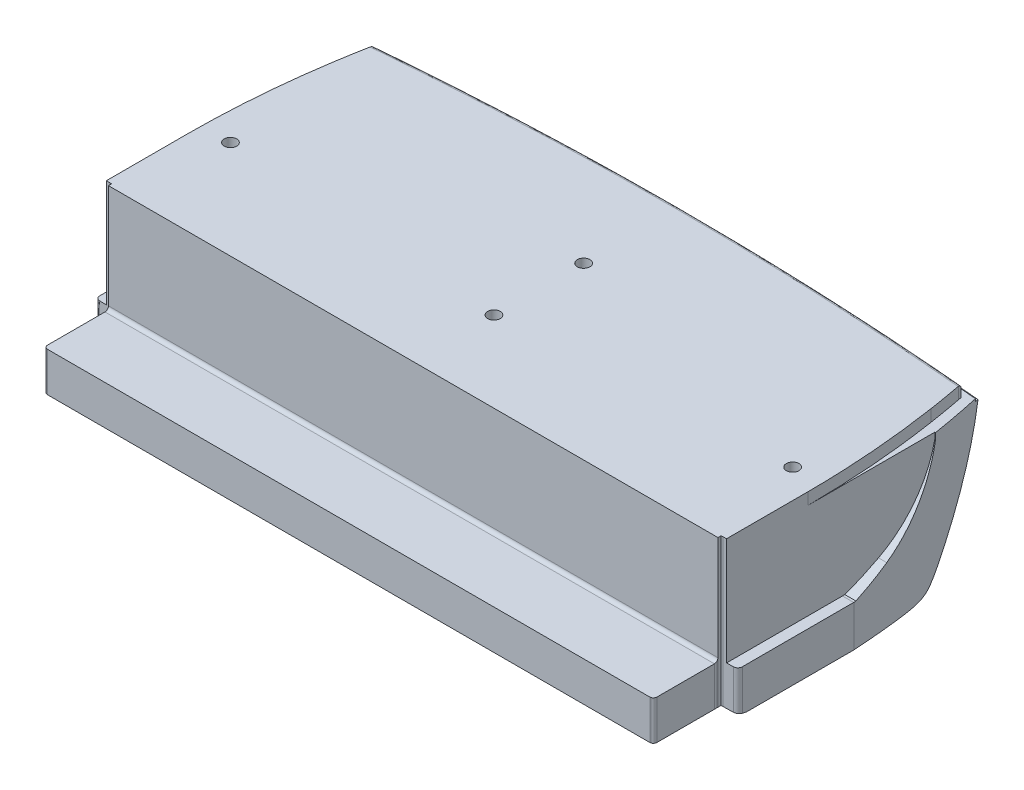
from build123d import *

# Parameters (mm, degrees)
EXTRUDE1_DEPTH  = 83.1088
SKETCH2_W       = 334.633680556
SKETCH2_H       = 172.186814414
EXTRUDE6_DEPTH  = 254
EXTRUDE10_DEPTH = 17.78
EXTRUDE16_DEPTH = 6.604
SKETCH10_R      = 3.509772889
SKETCH10_R_2    = 3.509249669
SKETCH10_R_3    = 3.509772959
EXTRUDE17_DEPTH = 176.276


with BuildPart() as part:
    # Sketch1 → Extrude1 (new body)
    with BuildSketch(Plane(origin=(0, 0, 0), x_dir=(1, 0, 0), z_dir=(0, 1, 0))):
        with BuildLine():
            Line((-207.699388771, -36.262836927), (-201.859225583, -36.364792895))
            Line((-201.859225583, -36.364792895), (-200.909084364, -36.364792895))
            Line((-200.909084364, -36.364792895), (-200.909084364, -37.346053424))
            Line((-200.909084364, -37.346053424), (-200.909084364, -38.112346879))
            Line((-200.909084364, -38.112346879), (-200.917436757, -38.789320053))
            Line((-200.917436757, -38.789320053), (-200.917810577, -40.112042276))
            Line((-200.917810577, -40.112042276), (-200.917810577, -72.205259801))
            add(Edge.make_bspline(
                [(-200.917810577, -72.205259801), (-200.917810577, -73.756244079), (-199.417582741, -74.149320964)],
                knots=[5.497939437, 5.497939437, 5.497939437, 6.812199525, 6.812199525, 6.812199525], degree=2, weights=[1, 0.791748594, 1]))
            add(Edge.make_bspline(
                [(-199.417582741, -74.149320964), (-199.169610166, -74.213670079), (-198.913509248, -74.213670146)],
                knots=[5.244513203, 5.244513203, 5.244513203, 5.498499307, 5.498499307, 5.498499307], degree=2, weights=[1, 0.991947214, 1]))
            Line((-198.913509248, -74.213670146), (137.4926923, -74.213670146))
            add(Edge.make_bspline(
                [(137.4926923, -74.213670146), (137.747932481, -74.213407345), (137.995081635, -74.149233567)],
                knots=[3.927144254, 3.927144254, 3.927144254, 4.180266877, 4.180266877, 4.180266877], degree=2, weights=[1, 0.992001802, 1]))
            add(Edge.make_bspline(
                [(137.995081635, -74.149233567), (139.495309352, -73.756156283), (139.495308949, -72.205172019)],
                knots=[5.754171098, 5.754171098, 5.754171098, 7.068431177, 7.068431177, 7.068431177], degree=2, weights=[1, 0.791748597, 1]))
            Line((139.495308949, -72.205172019), (139.495300624, -40.112108815))
            Line((139.495300624, -40.112108815), (139.494514595, -38.789165181))
            Line((139.494514595, -38.789165181), (139.486573872, -38.112259087))
            Line((139.486573872, -38.112259087), (139.486573673, -37.343324955))
            Line((139.486573673, -37.343324955), (139.486573673, -36.364591291))
            Line((139.486573673, -36.364591291), (140.436921609, -36.364591292))
            Line((140.436921609, -36.364591292), (146.277278399, -36.262631958))
            add(Edge.make_bspline(
                [(146.277278399, -36.262631958), (146.33152012, -36.260657839), (146.443556475, -36.256580294), (146.616342519, -36.235544425), (146.798883313, -36.200776153), (146.990706542, -36.14843306), (147.262078592, -36.049923395), (147.624232751, -35.860606543), (147.997209877, -35.55649622), (148.329947502, -35.154600987), (148.536054616, -34.767592437), (148.6448066, -34.432679777), (148.696791947, -34.198574458), (148.726521986, -33.987693091), (148.730339472, -33.834161403), (148.732108545, -33.763012736)],
                knots=[0, 0, 0, 0, 0.041985804, 0.086721741, 0.134525257, 0.185674931, 0.240411709, 0.357706501, 0.500029584, 0.609523385, 0.75962755, 0.835707573, 0.88129584, 0.944990882, 1, 1, 1, 1], degree=3))
            Line((148.732108545, -33.763012736), (148.732110725, 28.664467056))
            ThreePointArc((148.732110725, 28.664467056), (144.542935222, 69.269652632), (137.241112835, 109.431994158))
            add(Edge.make_bspline(
                [(137.241112835, 109.431994158), (56.128520722, 116.935356971), (-30.711283038, 116.935472975)],
                knots=[0, 0, 0, 1, 1, 1], degree=2))
            add(Edge.make_bspline(
                [(-30.711283038, 116.935472975), (-117.551072138, 116.93536767), (-198.663678911, 109.431994158)],
                knots=[0, 0, 0, 1, 1, 1], degree=2))
            ThreePointArc((-198.663678911, 109.431994158), (-205.966347497, 69.271841004), (-210.154202132, 28.668531492))
            Line((-210.154202132, 28.668531492), (-210.154199764, -33.763218347))
            add(Edge.make_bspline(
                [(-210.154199764, -33.763218347), (-210.153151329, -33.818371868), (-210.151099612, -33.926303669), (-210.135070562, -34.083876454), (-210.111219921, -34.232923555), (-210.080126009, -34.372969421), (-210.043248932, -34.503674538), (-210.002397334, -34.625195679), (-209.971129806, -34.701949398), (-209.955975417, -34.739149517)],
                knots=[0, 0, 0, 0, 0.165025915, 0.322944824, 0.473511561, 0.616560678, 0.751999706, 0.879802041, 1, 1, 1, 1], degree=3))
            add(Edge.make_bspline(
                [(-209.955975417, -34.739149517), (-209.933716657, -34.789041613), (-209.890331486, -34.886287686), (-209.815542814, -35.022852969), (-209.737589256, -35.14800839), (-209.657017379, -35.261924374), (-209.519095722, -35.436203085), (-209.313461669, -35.646134846), (-209.015725309, -35.870753181), (-208.701235544, -36.043403934), (-208.406869775, -36.153475245), (-208.150434073, -36.216783488), (-207.928729181, -36.252659832), (-207.777065469, -36.259389985), (-207.699388771, -36.262836927)],
                knots=[0, 0, 0, 0, 0.056912419, 0.110929582, 0.162104727, 0.210514881, 0.256258395, 0.393681691, 0.515355032, 0.643842173, 0.766318046, 0.841825603, 0.918988764, 1, 1, 1, 1], degree=3))
        make_face()
    extrude(amount=EXTRUDE1_DEPTH)

    # Sketch2 → Extrude6 (cut, symmetric)
    with BuildSketch(Plane(origin=(0, 0, 0), x_dir=(0, 0, -1), z_dir=(1, 0, 0))):
        with Locations((30.235062412, 36.825931839)):
            Rectangle(SKETCH2_W, SKETCH2_H)
        with BuildLine():
            Line((-74.213670146, 22.998484458), (-74.213670146, 1.000001012))
            Line((-74.213670146, 1.000001012), (-36.017332103, 0.999999987))
            Line((-36.017332103, 0.999999987), (-31.517332091, 0))
            Line((-31.517332091, 0), (116.935472975, 0))
            Line((116.935472975, 0), (116.935472975, 83.1088))
            Line((116.935472975, 83.1088), (-38.145610708, 83.1088))
            Line((-38.145610708, 83.1088), (-38.145610708, 24.964896554))
            ThreePointArc((-38.145610708, 24.964896554), (-38.721662011, 23.574381075), (-40.112241562, 22.998484458))
            Line((-40.112241562, 22.998484458), (-74.213670146, 22.998484458))
        make_face(mode=Mode.SUBTRACT)
    extrude(amount=EXTRUDE6_DEPTH, both=True, mode=Mode.SUBTRACT)

    # Sketch4 → Cut-Revolve10 (revolve, cut)
    with BuildSketch(Plane(origin=(-30.711283037, 0, 0), x_dir=(0, 0, -1), z_dir=(1, 0, 0))):
        with BuildLine():
            Line((60.887133919, 0.005665668), (60.887133919, -17.541530033))
            Line((60.887133919, -17.541530033), (128.158773627, -17.541530033))
            Line((128.158773627, -17.541530033), (128.158773627, 90.111168578))
            Line((128.158773627, 90.111168578), (-52.048051629, 90.111168578))
            Line((-52.048051629, 90.111168578), (-52.048051629, 83.108340195))
            Line((-52.048051629, 83.108340195), (109.195265606, 83.108340195))
            add(Edge.make_bspline(
                [(111.194695683, 81.160812541), (111.192649061, 81.205620462), (111.188581414, 81.294675873), (111.171300674, 81.426349013), (111.146446032, 81.55447807), (111.113893359, 81.678092262), (111.074652443, 81.79637739), (111.029564241, 81.908658528), (110.979599481, 82.014416935), (110.925741597, 82.113288408), (110.868979514, 82.205057726), (110.810276658, 82.28964688), (110.750551588, 82.367099473), (110.690661826, 82.43756252), (110.63139306, 82.50126709), (110.573452772, 82.558508927), (110.517467842, 82.609629969), (110.463985401, 82.655001395), (110.413476144, 82.695008626), (110.36555714, 82.730619796), (110.318908096, 82.763254233), (110.272046393, 82.794119233), (110.224209723, 82.823733915), (110.17545056, 82.852052248), (110.12582421, 82.879031155), (110.075388571, 82.904630749), (110.024203913, 82.928814511), (109.972332583, 82.951549501), (109.919838938, 82.97280636), (109.866788316, 82.992559987), (109.752991543, 83.031302804), (109.579306317, 83.076083898), (109.401496546, 83.099625733), (109.287540394, 83.106480921), (109.245272593, 83.107818629), (109.218706649, 83.108222844), (109.20614039, 83.108316544), (109.199133181, 83.108338796), (109.196874965, 83.108339613), (109.195265606, 83.108340195)],
                knots=[0, 0, 0, 0, 0.043404273, 0.086265671, 0.128412388, 0.169680359, 0.209915728, 0.248976855, 0.286735778, 0.323079145, 0.357908595, 0.391140669, 0.422706294, 0.452549926, 0.480628441, 0.506909842, 0.531371871, 0.554000576, 0.574788903, 0.593735337, 0.611786155, 0.629892723, 0.648047296, 0.666242007, 0.684468898, 0.702719935, 0.720987033, 0.739262074, 0.75753693, 0.775803478, 0.79405363, 0.873892125, 0.949052494, 0.966899977, 0.984842289, 0.989268389, 0.993554611, 0.995406577, 0.999999919, 0.999999919, 0.999999919, 0.999999919], degree=3))
            Line((111.194695683, 81.160812541), (111.316797386, 76.508465822))
            Line((111.316797386, 76.508465822), (115.088378734, 76.508465822))
            Line((115.088378734, 76.508465822), (114.970269496, 75.15846583))
            Line((114.970269496, 75.15846583), (114.957158132, 75.008601676))
            Line((114.957158132, 75.008601676), (116.846155171, 75.008489801))
            ThreePointArc((116.846155171, 75.008489801), (113.406612642, 60.886577151), (108.589915575, 47.173142166))
            add(Edge.make_bspline(
                [(108.589915575, 47.173142166), (104.644545523, 37.637521132), (99.986679016, 28.397256591), (94.667753073, 19.55400659)],
                knots=[0, 0, 0, 0, 1, 1, 1, 1], degree=3))
            add(Edge.make_bspline(
                [(94.667753073, 19.55400659), (94.17101696, 18.733966409), (93.67722059, 17.924357831), (92.696598832, 16.329948101), (92.209690123, 15.545070398), (91.235518706, 13.991230294), (90.749172779, 13.222249815), (89.769705862, 11.696453174), (89.274826378, 10.937979405), (88.267298208, 9.44811023), (87.755019387, 8.718428342), (86.712388004, 7.306770333), (86.182268328, 6.623994691), (85.073203708, 5.312223405), (84.489865503, 4.681316365), (83.224927942, 3.513776184), (82.545520924, 2.980379097), (81.073092268, 2.086491222), (80.275138792, 1.73072686), (78.647133509, 1.172451285), (77.818622437, 0.968092749), (76.164620692, 0.649174737), (75.332733914, 0.53226993), (73.633847948, 0.343984262), (72.764103571, 0.273817775), (70.998494672, 0.168715999), (70.104102483, 0.134237401), (68.308833787, 0.082323188), (67.406157028, 0.06437947), (65.582386755, 0.034075746), (64.661958462, 0.023051179), (62.795224859, 0.008830376), (61.847734021, 0.00549382), (60.887133919, 0.005665668)],
                knots=[0, 0, 0, 0, 0.0625, 0.0625, 0.125, 0.125, 0.1875, 0.1875, 0.25, 0.25, 0.3125, 0.3125, 0.375, 0.375, 0.4375, 0.4375, 0.5, 0.5, 0.5625, 0.5625, 0.625, 0.625, 0.6875, 0.6875, 0.75, 0.75, 0.8125, 0.8125, 0.875, 0.875, 0.9375, 0.9375, 1, 1, 1, 1], degree=3))
        make_face()
    revolve(axis=Axis((-30.711283037, -6.833611141, 1768.1194), (0, 1, 0)), mode=Mode.SUBTRACT)

    # Sketch8 → Extrude10 (cut)
    with BuildSketch(Plane(origin=(-203.905801045, 0, 7.736e-06), x_dir=(3.7939571623733516e-08, 0, 0.9999999999999994), z_dir=(-0.9999999999999994, 0, 3.7939571623733516e-08))):
        with BuildLine():
            Line((-29.756656564, 23.047222004), (-28.4268122, 23.042694804))
            Line((-28.4268122, 23.042694804), (119.767465885, 22.999899024))
            Line((119.767465885, 22.999899024), (119.767465885, 102.614236403))
            Line((119.767465885, 102.614236403), (-80.067045162, 102.614236403))
            Line((-80.067045162, 102.614236403), (-80.067045162, 73.403812984))
            add(Edge.make_bspline(
                [(-80.067045162, 73.403812984), (-79.912318085, 72.676767044), (-79.601868537, 71.217997911), (-79.033240019, 69.046464809), (-78.386620416, 66.882391332), (-77.65402484, 64.730687136), (-76.836905489, 62.594367927), (-75.367155124, 59.146289924), (-72.936506868, 54.434973824), (-69.210156115, 48.839864409), (-64.813109012, 43.597430852), (-61.306520608, 40.254787179), (-59.035780223, 38.356066101), (-58.303738113, 37.76272231), (-57.547154044, 37.168815443), (-56.765629753, 36.575205455), (-55.958798086, 35.982801411), (-55.126303649, 35.392536757), (-54.267808729, 34.805379439), (-53.382999929, 34.222317582), (-52.471565401, 33.644408459), (-51.533292532, 33.072592691), (-50.567701932, 32.508406079), (-49.575459536, 31.951251198), (-48.899602942, 31.592725485), (-48.558775617, 31.411924764)],
                knots=[0, 0, 0, 0, 0.040973529, 0.08221065, 0.123713513, 0.165484234, 0.207524896, 0.249837548, 0.372237202, 0.499507193, 0.620485873, 0.750059968, 0.76710359, 0.784510729, 0.802281452, 0.820415825, 0.838913912, 0.857775779, 0.877001488, 0.896591105, 0.916544691, 0.936862311, 0.957544027, 0.978589902, 1, 1, 1, 1], degree=3))
            add(Edge.make_bspline(
                [(-48.558775617, 31.411924764), (-48.118016813, 31.182709531), (-47.241490073, 30.726874551), (-45.926256285, 30.062198395), (-44.620556764, 29.416045361), (-43.324126319, 28.789140069), (-42.037414379, 28.180845419), (-40.760670877, 27.590883301), (-39.494187087, 27.018881904), (-38.238232612, 26.464494606), (-36.993071419, 25.927370868), (-35.758960539, 25.40715699), (-34.536140633, 24.903522247), (-33.324875181, 24.416056629), (-32.1253067, 23.944647903), (-30.937983974, 23.48810193), (-30.148673344, 23.193525499), (-29.756656564, 23.047222004)],
                knots=[0, 0, 0, 0, 0.072406623, 0.14399336, 0.214760182, 0.28470706, 0.353833969, 0.422140883, 0.489627779, 0.556294634, 0.622141429, 0.687168145, 0.751374765, 0.814761273, 0.877327655, 0.939073901, 1, 1, 1, 1], degree=3))
        make_face()
    extrude10 = extrude(amount=EXTRUDE10_DEPTH, mode=Mode.SUBTRACT)

    # Mirror1: Extrude10 across plane
    add(extrude10.mirror(Plane(origin=(-30.711283037, 0, 0), x_dir=(0, 0, 1), z_dir=(1, 0, 0))), mode=Mode.SUBTRACT)

    # Sketch9 → Extrude16 (cut)
    with BuildSketch(Plane(origin=(0, 76.508465822, 0.004689484), x_dir=(1, 0, 0), z_dir=(0, 1, 0))):
        with BuildLine():
            Line((-203.90580127, 5.951143188), (-212.711821072, 5.951143188))
            Line((-212.711821072, 5.951143188), (-212.711821072, 157.02189444))
            Line((-212.711821072, 157.02189444), (158.390678723, 157.02189444))
            Line((158.390678723, 157.02189444), (158.390678723, 5.957433074))
            Line((158.390678723, 5.957433074), (142.483235196, 5.957433074))
            add(Edge.make_bspline(
                [(142.483235196, 5.957433074), (142.568838086, 31.929876279), (140.62664032, 57.908747942), (136.680139154, 83.57974836)],
                knots=[0, 0, 0, 0, 1, 1, 1, 1], degree=3))
            ThreePointArc((136.680139154, 83.57974836), (135.142298846, 92.980599076), (133.425646763, 102.350447135))
            ThreePointArc((133.425646763, 102.350447135), (131.621252438, 111.251755308), (129.652066579, 120.118064186))
            Line((129.652066579, 120.118064186), (-188.956913512, 129.032302448))
            ThreePointArc((-188.956913512, 129.032302448), (-192.082503097, 115.731098089), (-194.848220471, 102.350434612))
            add(Edge.make_bspline(
                [(-194.848220471, 102.350434612), (-196.046792846, 96.142541457), (-197.127600526, 89.911911422), (-198.089865974, 83.663026853)],
                knots=[0, 0, 0, 0, 1, 1, 1, 1], degree=3))
            ThreePointArc((-198.089865974, 83.663026853), (-202.514145707, 44.920565386), (-203.90580127, 5.951143188))
        make_face()
    extrude(amount=EXTRUDE16_DEPTH, mode=Mode.SUBTRACT)

    # Sketch10 → Extrude17 (cut)
    with BuildSketch(Plane(origin=(0, 83.108340195, 0), x_dir=(1, 0, 0), z_dir=(0, 1, 0))):
        with Locations(Location((-187.711283032, 16.779783584, 0), (0, 0, 270))):
            Circle(SKETCH10_R)
        with Locations(Location((-30.711283037, 57.039783582, 0), (0, 0, 270))):
            Circle(SKETCH10_R_2)
        with Locations(Location((-30.711283037, 6.939783579, 0), (0, 0, 270))):
            Circle(SKETCH10_R_2)
        with Locations(Location((126.288716958, 16.779783584, 0), (0, 0, 270))):
            Circle(SKETCH10_R_3)
    extrude(amount=-EXTRUDE17_DEPTH, mode=Mode.SUBTRACT)


solid = part.part
